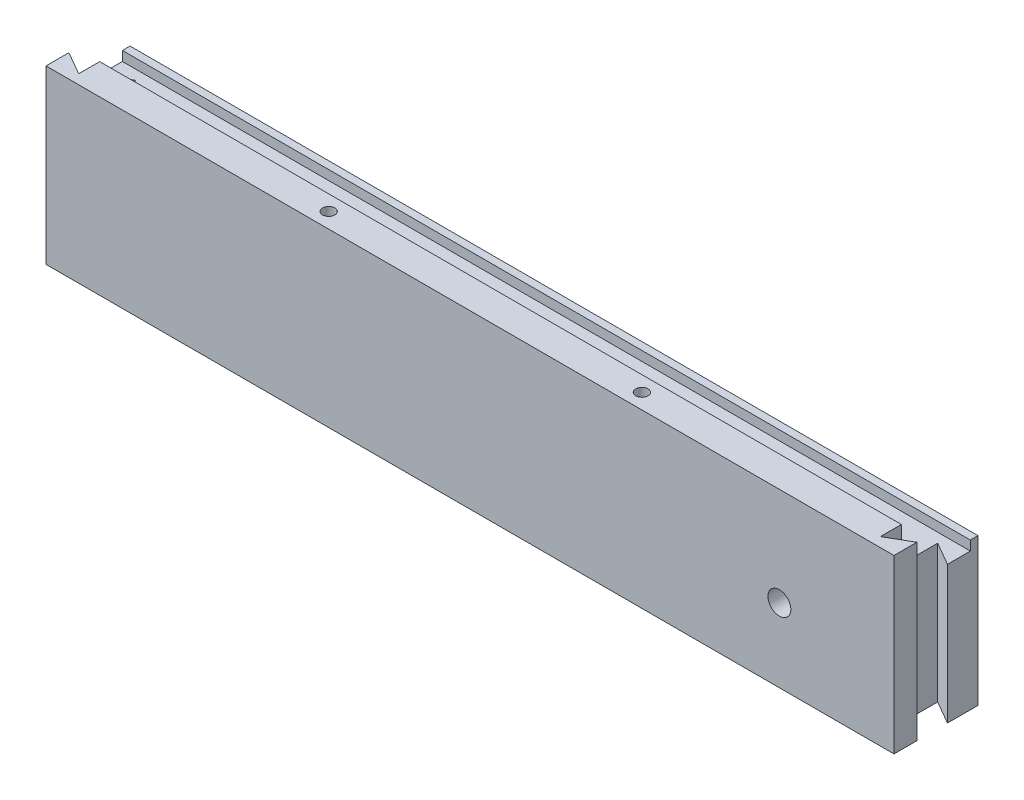
from build123d import *

# Parameters (mm, degrees)
SKETCH_1_W           = 270
SKETCH_1_H           = 370
SKETCH_1_W_2         = 250
SKETCH_1_H_2         = 350
EXTRUDE_2_DEPTH      = 45
SKETCH_4_W           = 250
SKETCH_4_H           = 350
SKETCH_4_W_2         = 222
SKETCH_4_H_2         = 322
EXTRUDE_3_DEPTH      = 5
SKETCH_9_W           = 246
SKETCH_9_H           = 346
SKETCH_9_W_2         = 226
SKETCH_9_H_2         = 326
CUT_EXTRUDE_3_DEPTH  = 2.5
SKETCH_12_R          = 1.6
CUT_EXTRUDE_5_DEPTH  = 109.5
FILLET_1_R           = 5
SKETCH_13_W          = 250
SKETCH_13_H          = 350
SKETCH_13_W_2        = 222
SKETCH_13_H_2        = 322
EXTRUDE_4_DEPTH      = 33.5
CUT_EXTRUDE_START    = -126.5
CUT_EXTRUDE_8_DEPTH  = 126.5
SKETCH_15_W          = 209.875644348
SKETCH_15_H          = 2
CUT_EXTRUDE_9_DEPTH  = 2.5
CUT_EXTRUDE_10_DEPTH = 60.5
SKETCH_18_R          = 1.6
CUT_EXTRUDE_11_DEPTH = 60.5
SKETCH_21_R          = 3
CUT_EXTRUDE_14_DEPTH = 40


with BuildPart() as part:
    # 草图1 → 凸台-拉伸2 (new body)
    with BuildSketch(Plane(origin=(0, 0, 0), x_dir=(1, 0, 0), z_dir=(0, 1, 0))):
        with Locations((125, 175)):
            Rectangle(SKETCH_1_W, SKETCH_1_H)
        with Locations((125, 175)):
            Rectangle(SKETCH_1_W_2, SKETCH_1_H_2, mode=Mode.SUBTRACT)
    extrude(amount=EXTRUDE_2_DEPTH)

    # 草图4 → 凸台-拉伸3 (add)
    with BuildSketch(Plane(origin=(0, 38.5, 0), x_dir=(1, 0, 0), z_dir=(0, 1, 0))):
        with Locations((125, 175)):
            Rectangle(SKETCH_4_W, SKETCH_4_H)
        with Locations((125, 175)):
            Rectangle(SKETCH_4_W_2, SKETCH_4_H_2, mode=Mode.SUBTRACT)
    extrude(amount=-EXTRUDE_3_DEPTH)

    # 草图9 → 切除-拉伸3 (cut)
    with BuildSketch(Plane(origin=(0, 38.5, 0), x_dir=(1, 0, 0), z_dir=(0, 1, 0))):
        with Locations((125, 175)):
            Rectangle(SKETCH_9_W, SKETCH_9_H)
        with Locations((125, 175)):
            Rectangle(SKETCH_9_W_2, SKETCH_9_H_2, mode=Mode.SUBTRACT)
    extrude(amount=-CUT_EXTRUDE_3_DEPTH, mode=Mode.SUBTRACT)

    # 草图12 → 切除-拉伸5 (cut)
    with BuildSketch(Plane(origin=(0, 45, 0), x_dir=(1, 0, 0), z_dir=(0, 1, 0))):
        with Locations((-5, 355)):
            Circle(SKETCH_12_R)
        with Locations((-5, -5)):
            Circle(SKETCH_12_R)
        with Locations((255, -5)):
            Circle(SKETCH_12_R)
        with Locations((255, 355)):
            Circle(SKETCH_12_R)
    extrude(amount=-CUT_EXTRUDE_5_DEPTH, mode=Mode.SUBTRACT)

    # 圆角1
    fillet_1_edges = [part.edges().sort_by_distance(p)[0] for p in [
        (260, 22.5, -360),
        (260, 22.5, 10),
        (-10, 22.5, 10),
        (-10, 22.5, -360),
    ]]
    fillet(fillet_1_edges, radius=FILLET_1_R)

    # 草图13 → 凸台-拉伸4 (add)
    with BuildSketch(Plane.XZ.offset(-33.5)):
        with Locations((125, -175)):
            Rectangle(SKETCH_13_W, SKETCH_13_H)
        with Locations((125, -175)):
            Rectangle(SKETCH_13_W_2, SKETCH_13_H_2, mode=Mode.SUBTRACT)
    extrude(amount=EXTRUDE_4_DEPTH)

    # 草图14 → 切除-拉伸8 (cut)
    with BuildSketch(Plane.XZ.offset(CUT_EXTRUDE_START)):
        with BuildLine():
            Line((14, -336), (14, -6))
            Line((14, -6), (20.062177826, -9.5))
            Line((20.062177826, -9.5), (20.062177826, 5.5))
            Line((20.062177826, 5.5), (14, 2))
            Line((14, 2), (14, 10))
            Line((14, 10), (-5, 10))
            ThreePointArc((-5, 10), (-8.535533906, 8.535533906), (-10, 5))
            Line((-10, 5), (-10, -355))
            ThreePointArc((-10, -355), (-8.535533906, -358.535533906), (-5, -360))
            Line((-5, -360), (255, -360))
            ThreePointArc((255, -360), (258.535533906, -358.535533906), (260, -355))
            Line((260, -355), (260, 5))
            ThreePointArc((260, 5), (258.535533906, 8.535533906), (255, 10))
            Line((255, 10), (236, 10))
            Line((236, 10), (236, 2))
            Line((236, 2), (229.937822174, 5.5))
            Line((229.937822174, 5.5), (229.937822174, -9.5))
            Line((229.937822174, -9.5), (236, -6))
            Line((236, -6), (236, -336))
            Line((236, -336), (14, -336))
        make_face()
    extrude(amount=CUT_EXTRUDE_8_DEPTH, mode=Mode.SUBTRACT)

    # 草图15 → 切除-拉伸9 (cut)
    with BuildSketch(Plane(origin=(0, 38.5, 0), x_dir=(1, 0, 0), z_dir=(0, 1, 0))):
        with Locations((125, 1)):
            Rectangle(SKETCH_15_W, SKETCH_15_H)
    extrude(amount=-CUT_EXTRUDE_9_DEPTH, mode=Mode.SUBTRACT)

    # 草图16 → 切除-拉伸10 (cut)
    with BuildSketch(Plane(origin=(0, 45, 0), x_dir=(1, 0, 0), z_dir=(0, 1, 0))):
        Polygon((236, -10), (236, -8), (234, -8), (229.607695155, -8), (14, -8), (14, -10), align=None)
    extrude(amount=-CUT_EXTRUDE_10_DEPTH, mode=Mode.SUBTRACT)

    # 草图18 → 切除-拉伸11 (cut)
    with BuildSketch(Plane(origin=(0, 45, 0), x_dir=(1, 0, 0), z_dir=(0, 1, 0))):
        with Locations((166, -4)):
            Circle(SKETCH_18_R)
        with Locations((84, -4)):
            Circle(SKETCH_18_R)
    extrude(amount=-CUT_EXTRUDE_11_DEPTH, mode=Mode.SUBTRACT)

    # 草图21 → 切除-拉伸14 (cut)
    with BuildSketch(Plane(origin=(0, 0, -14), x_dir=(-1, 0, 0), z_dir=(0, 0, -1))):
        with Locations((-206, 19.25)):
            Circle(SKETCH_21_R)
    extrude(amount=-CUT_EXTRUDE_14_DEPTH, mode=Mode.SUBTRACT)


solid = part.part
